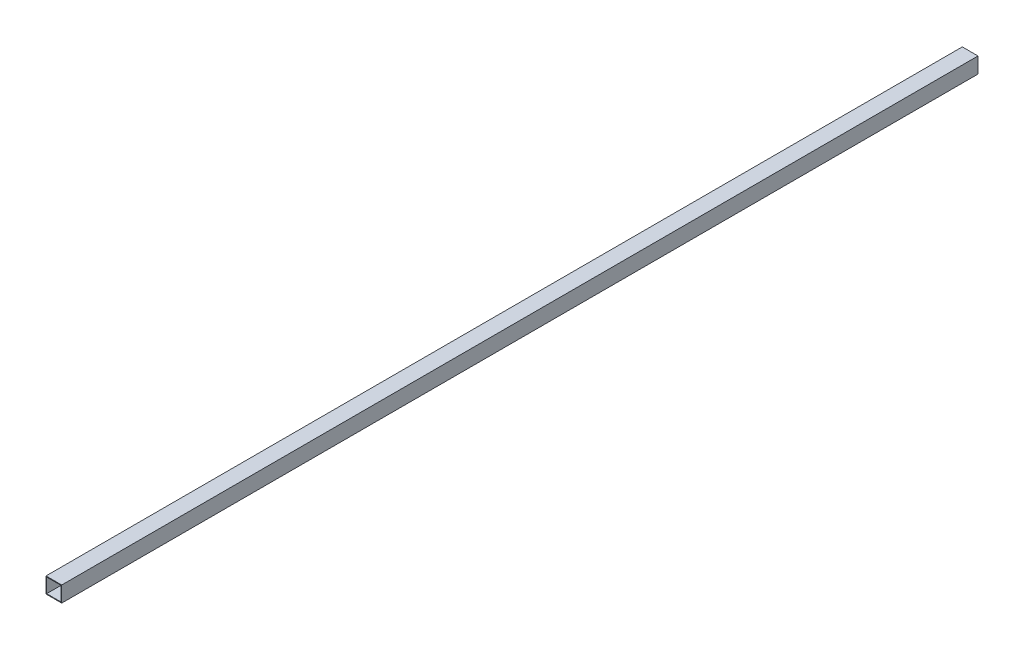
from build123d import *

# Parameters (mm, degrees)
SKETCH2_W           = 38.1
SKETCH2_H           = 38.1
SKETCH2_W_2         = 34.925
SKETCH2_H_2         = 34.925
BOSS_EXTRUDE1_DEPTH = 2222.5


with BuildPart() as part:
    # Sketch2 → Boss-Extrude1 (new body)
    with BuildSketch(Plane.XY):
        with Locations((19.05, 19.05)):
            Rectangle(SKETCH2_W, SKETCH2_H)
        with Locations((19.05, 19.05)):
            Rectangle(SKETCH2_W_2, SKETCH2_H_2, mode=Mode.SUBTRACT)
    extrude(amount=BOSS_EXTRUDE1_DEPTH)


solid = part.part
